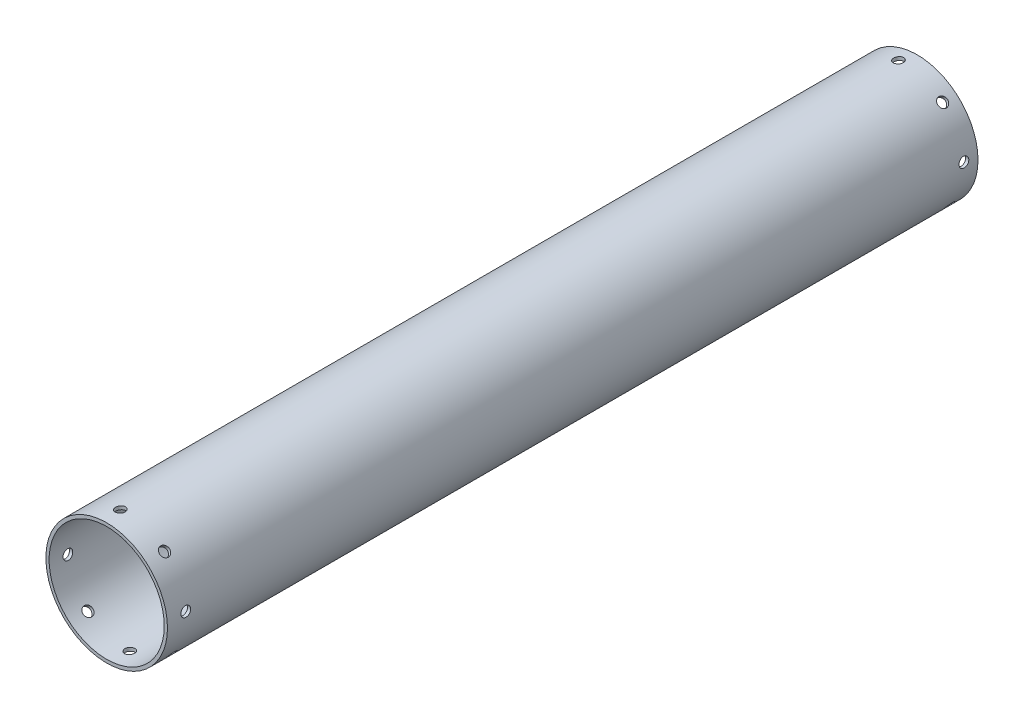
from build123d import *

# Parameters (mm, degrees)
SKETCH1_R           = 37.5
SKETCH1_R_2         = 35.5
BOSS_EXTRUDE1_DEPTH = 500
CIRPATTERN1_COUNT   = 8
LPATTERN1_COUNT     = 2
LPATTERN1_PITCH     = 480


with BuildPart() as part:
    # Sketch1 → Boss-Extrude1 (new body)
    with BuildSketch(Plane.XY):
        Circle(SKETCH1_R)
        Circle(SKETCH1_R_2, mode=Mode.SUBTRACT)
    extrude(amount=BOSS_EXTRUDE1_DEPTH)

    # Sketch4 → 1/4 (0.236) Diameter Hole1 (revolve, cut)
    with BuildSketch(Plane(origin=(-3.032244698, 37.377205515, 488.562943744), x_dir=(-0.9967254803942281, -0.08085985860051416, 0), z_dir=(0, 0, 1))):
        Polygon((0, 0), (0, 6.1), (2.9972, 4.299100553), (2.9972, 0), align=None)
    f_1_4_0_236_diameter_hole1 = revolve(axis=Axis((-3.5457048, 43.706412315, 488.562943744), (0.08085985860051416, -0.9967254803942281, 0)), mode=Mode.SUBTRACT)

    # CirPattern1: 1/4 (0.236) Diameter Hole1 ×8 about axis
    cirpattern1_axis = Axis((0, 0, 500), (0, 0, -1))
    for i in range(1, CIRPATTERN1_COUNT):
        add(f_1_4_0_236_diameter_hole1.rotate(cirpattern1_axis, i * 360 / CIRPATTERN1_COUNT), mode=Mode.SUBTRACT)

    # LPattern1: 1/4 (0.236) Diameter Hole1 ×2
    with Locations(*[(0, 0, -i * LPATTERN1_PITCH) for i in range(1, LPATTERN1_COUNT)]):
        add(f_1_4_0_236_diameter_hole1, mode=Mode.SUBTRACT)

    # LPattern1 copy 1 sketch → LPattern1 copy 1 (revolve, cut)
    with BuildSketch(Plane(origin=(24.285554693, 28.573796269, 8.562943744), x_dir=(-0.7619679005103869, 0.6476147918259689, 0), z_dir=(0, 0, 1))):
        Polygon((0, 0), (0, 6.1), (2.9972, 4.299100553), (2.9972, 0), align=None)
    revolve(axis=Axis((28.397908622, 33.412292437, 8.562943744), (-0.6476147918259689, -0.7619679005103869, 0)), mode=Mode.SUBTRACT)

    # LPattern1 copy 2 sketch → LPattern1 copy 2 (revolve, cut)
    with BuildSketch(Plane(origin=(37.377205515, 3.032244698, 8.562943744), x_dir=(-0.08085985860051421, 0.9967254803942281, 0), z_dir=(0, 0, 1))):
        Polygon((0, 0), (0, 6.1), (2.9972, 4.299100553), (2.9972, 0), align=None)
    revolve(axis=Axis((43.706412315, 3.5457048, 8.562943744), (-0.9967254803942281, -0.08085985860051421, 0)), mode=Mode.SUBTRACT)

    # LPattern1 copy 3 sketch → LPattern1 copy 3 (revolve, cut)
    with BuildSketch(Plane(origin=(28.573796269, -24.285554693, 8.562943744), x_dir=(0.6476147918259689, 0.7619679005103869, 0), z_dir=(0, 0, 1))):
        Polygon((0, 0), (0, 6.1), (2.9972, 4.299100553), (2.9972, 0), align=None)
    revolve(axis=Axis((33.412292437, -28.397908622, 8.562943744), (-0.7619679005103869, 0.6476147918259689, 0)), mode=Mode.SUBTRACT)

    # LPattern1 copy 4 sketch → LPattern1 copy 4 (revolve, cut)
    with BuildSketch(Plane(origin=(3.032244698, -37.377205515, 8.562943744), x_dir=(0.9967254803942281, 0.08085985860051428, 0), z_dir=(0, 0, 1))):
        Polygon((0, 0), (0, 6.1), (2.9972, 4.299100553), (2.9972, 0), align=None)
    revolve(axis=Axis((3.5457048, -43.706412315, 8.562943744), (-0.08085985860051428, 0.9967254803942281, 0)), mode=Mode.SUBTRACT)

    # LPattern1 copy 5 sketch → LPattern1 copy 5 (revolve, cut)
    with BuildSketch(Plane(origin=(-24.285554693, -28.573796269, 8.562943744), x_dir=(0.761967900510387, -0.6476147918259689, 0), z_dir=(0, 0, 1))):
        Polygon((0, 0), (0, 6.1), (2.9972, 4.299100553), (2.9972, 0), align=None)
    revolve(axis=Axis((-28.397908622, -33.412292437, 8.562943744), (0.6476147918259689, 0.761967900510387, 0)), mode=Mode.SUBTRACT)

    # LPattern1 copy 6 sketch → LPattern1 copy 6 (revolve, cut)
    with BuildSketch(Plane(origin=(-37.377205515, -3.032244698, 8.562943744), x_dir=(0.08085985860051434, -0.9967254803942281, 0), z_dir=(0, 0, 1))):
        Polygon((0, 0), (0, 6.1), (2.9972, 4.299100553), (2.9972, 0), align=None)
    revolve(axis=Axis((-43.706412315, -3.5457048, 8.562943744), (0.9967254803942281, 0.08085985860051434, 0)), mode=Mode.SUBTRACT)

    # LPattern1 copy 7 sketch → LPattern1 copy 7 (revolve, cut)
    with BuildSketch(Plane(origin=(-28.573796269, 24.285554693, 8.562943744), x_dir=(-0.6476147918259688, -0.761967900510387, 0), z_dir=(0, 0, 1))):
        Polygon((0, 0), (0, 6.1), (2.9972, 4.299100553), (2.9972, 0), align=None)
    revolve(axis=Axis((-33.412292437, 28.397908622, 8.562943744), (0.761967900510387, -0.6476147918259688, 0)), mode=Mode.SUBTRACT)


solid = part.part
